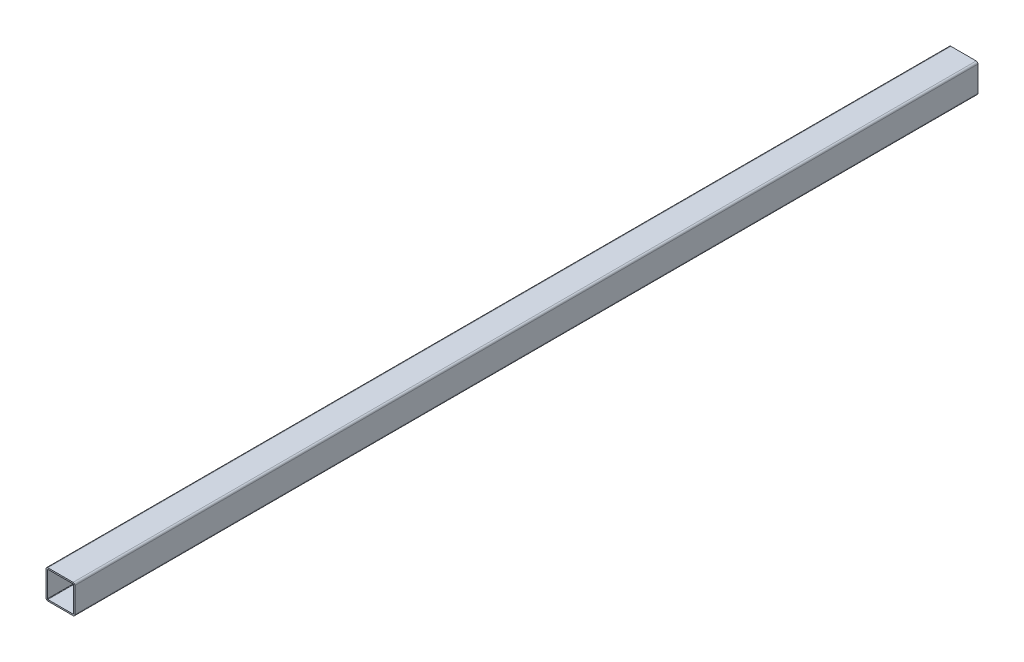
from build123d import *

# Parameters (mm, degrees)
BOSS_EXTRUDE1_DEPTH      = 500
BOSS_EXTRUDE1_DEPTH_BACK = 500


with BuildPart() as part:
    # Sketch1 → Boss-Extrude1 (new, two sides: drawn at the far end of the back side and taken through both)
    with BuildSketch(Plane.XY.offset(-BOSS_EXTRUDE1_DEPTH_BACK)):
        with BuildLine():
            Line((-14, -16), (14, -16))
            ThreePointArc((14, -16), (15.414213562, -15.414213562), (16, -14))
            Line((16, -14), (16, 14))
            ThreePointArc((16, 14), (15.414213562, 15.414213562), (14, 16))
            Line((14, 16), (-14, 16))
            ThreePointArc((-14, 16), (-15.414213562, 15.414213562), (-16, 14))
            Line((-16, 14), (-16, -14))
            ThreePointArc((-16, -14), (-15.414213562, -15.414213562), (-14, -16))
        make_face()
        with BuildLine():
            Line((-14, 14.48), (14, 14.48))
            ThreePointArc((14, 14.48), (14.339411255, 14.339411255), (14.48, 14))
            Line((14.48, 14), (14.48, -14))
            ThreePointArc((14.48, -14), (14.339411255, -14.339411255), (14, -14.48))
            Line((14, -14.48), (-14, -14.48))
            ThreePointArc((-14, -14.48), (-14.339411255, -14.339411255), (-14.48, -14))
            Line((-14.48, -14), (-14.48, 14))
            ThreePointArc((-14.48, 14), (-14.339411255, 14.339411255), (-14, 14.48))
        make_face(mode=Mode.SUBTRACT)
    extrude(amount=BOSS_EXTRUDE1_DEPTH + BOSS_EXTRUDE1_DEPTH_BACK)


solid = part.part
